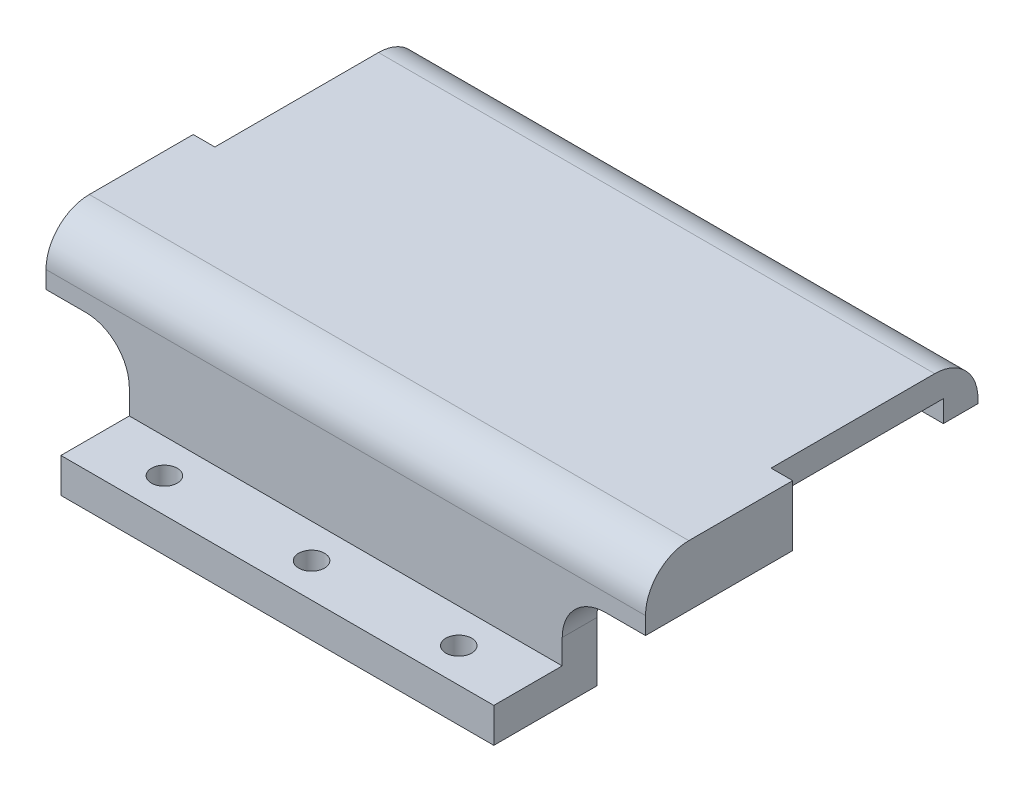
from build123d import *

# Parameters (mm, degrees)
SKETCH1_W             = 81.5848
SKETCH1_H             = 51.943
BOSS_EXTRUDE1_DEPTH   = 3.81
SKETCH2_W             = 63.5
SKETCH2_H             = 5.08
BOSS_EXTRUDE2_DEPTH   = 20.1168
SKETCH3_W             = 81.5848
SKETCH3_H             = 5.08
BOSS_EXTRUDE3_DEPTH   = 3.175
SKETCH4_W             = 63.5
SKETCH4_H             = 5.08
BOSS_EXTRUDE4_DEPTH   = 10.033
SKETCH6_W             = 3.175
SKETCH6_H             = 21.59
BOSS_EXTRUDE5_DEPTH   = 8.89
FILLET1_R             = 6.35
SKETCH7_W             = 9.0424
SKETCH7_H             = 5.08
BOSS_EXTRUDE6_DEPTH   = 5.08
FILLET2_R             = 6.35
FILLET3_R             = 6.35
SKETCH8_W             = 1.27
SKETCH8_H             = 41.783
BOSS_EXTRUDE7_DEPTH   = 3.175
F_6_CLEARANCE_HOLE1_D = 3.7973


with BuildPart() as part:
    # Sketch1 → Boss-Extrude1 (new body)
    with BuildSketch(Plane(origin=(0, 0, 0), x_dir=(1, 0, 0), z_dir=(0, 1, 0))):
        Rectangle(SKETCH1_W, SKETCH1_H)
    extrude(amount=BOSS_EXTRUDE1_DEPTH)

    # Sketch2 → Boss-Extrude2 (add)
    with BuildSketch(Plane.XZ):
        with Locations((0, 23.4315)):
            Rectangle(SKETCH2_W, SKETCH2_H)
    extrude(amount=BOSS_EXTRUDE2_DEPTH)

    # Sketch3 → Boss-Extrude3 (add)
    with BuildSketch(Plane.XZ):
        with Locations((0, -23.4315)):
            Rectangle(SKETCH3_W, SKETCH3_H)
    extrude(amount=BOSS_EXTRUDE3_DEPTH)

    # Sketch4 → Boss-Extrude4 (add)
    with BuildSketch(Plane.XY.offset(25.9715)):
        with Locations((0, -17.5768)):
            Rectangle(SKETCH4_W, SKETCH4_H)
    extrude(amount=BOSS_EXTRUDE4_DEPTH)

    # Sketch6 → Boss-Extrude5 (add)
    with BuildSketch(Plane(origin=(0, 3.81, 0), x_dir=(1, 0, 0), z_dir=(0, 1, 0))):
        with Locations((-42.3799, -15.1765)):
            Rectangle(SKETCH6_W, SKETCH6_H)
        with Locations((42.3799, -15.1765)):
            Rectangle(SKETCH6_W, SKETCH6_H)
    extrude(amount=-BOSS_EXTRUDE5_DEPTH)

    # Fillet1
    fillet1_edges = [part.edges().sort_by_distance(p)[0] for p in [
        (0, 3.81, -25.9715),
    ]]
    fillet(fillet1_edges, radius=FILLET1_R)

    # Sketch7 → Boss-Extrude6 (add)
    with BuildSketch(Plane.XY.offset(25.9715)):
        with Locations((36.2712, -2.54)):
            Rectangle(SKETCH7_W, SKETCH7_H)
        with Locations((-36.2712, -2.54)):
            Rectangle(SKETCH7_W, SKETCH7_H)
    extrude(amount=-BOSS_EXTRUDE6_DEPTH)

    # Fillet2
    fillet2_edges = [part.edges().sort_by_distance(p)[0] for p in [
        (-31.75, -5.08, 23.4315),
        (31.75, -5.08, 23.4315),
    ]]
    fillet(fillet2_edges, radius=FILLET2_R)

    # Fillet3
    fillet3_edges = [part.edges().sort_by_distance(p)[0] for p in [
        (0, 3.81, 25.9715),
    ]]
    fillet(fillet3_edges, radius=FILLET3_R)

    # Sketch8 → Boss-Extrude7 (add)
    with BuildSketch(Plane.XZ):
        Rectangle(SKETCH8_W, SKETCH8_H)
    extrude(amount=BOSS_EXTRUDE7_DEPTH)

    # #6 Clearance Hole1 (through all)
    with Locations(Plane(origin=(21.59, -15.0368, 30.988), x_dir=(0, 0, 1), z_dir=(0, 1, 0))):
        with Locations((0, 0), (0, -43.18), (0, -21.59)):
            Hole(F_6_CLEARANCE_HOLE1_D / 2)


solid = part.part
